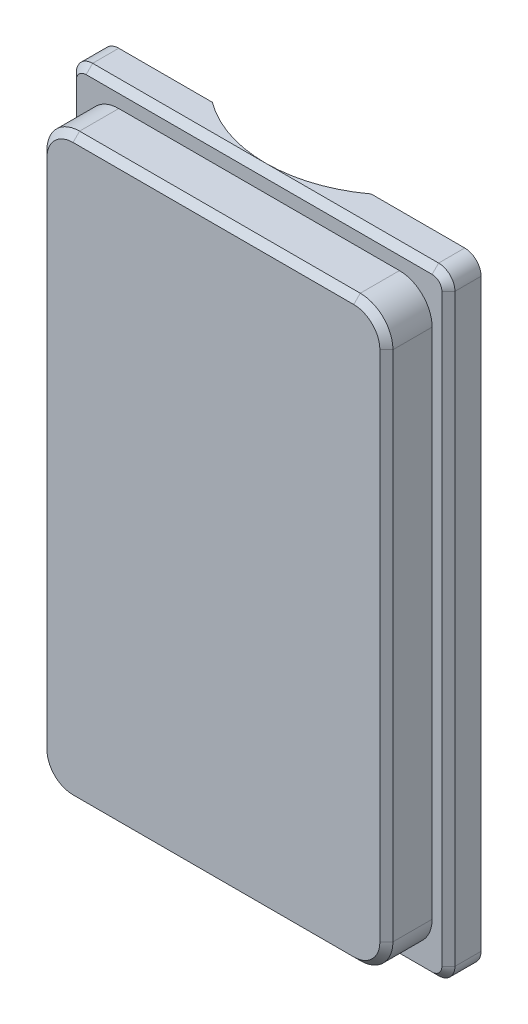
from build123d import *

# Parameters (mm, degrees)
EXTRUDE_1_DEPTH     = 1
SKETCH_3_W          = 5.3
SKETCH_3_H          = 17.71
EXTRUDE_2_DEPTH     = 1.4
FILLET_1_R          = 1
CHAMFER_1_SIZE      = 0.2
CUT_EXTRUDE_1_DEPTH = 0.5
SKETCH_5_R          = 4.1
CUT_EXTRUDE_2_DEPTH = 20.924560345


with BuildPart() as part:
    # 草图1 → 凸台-拉伸1 (new body)
    with BuildSketch(Plane(origin=(0, 0, 0), x_dir=(-1, 0, 0), z_dir=(0, 0, 1))):
        with BuildLine():
            Line((-5.8, 61.063), (-5.8, 78.973))
            ThreePointArc((-5.8, 78.973), (-5.653553391, 79.32655339), (-5.3, 79.473))
            Line((-5.3, 79.473), (0, 79.473))
            Line((0, 79.473), (0, 60.563))
            Line((0, 60.563), (-5.3, 60.563))
            ThreePointArc((-5.3, 60.563), (-5.653553391, 60.709446609), (-5.8, 61.063))
        make_face()
    extrude(amount=EXTRUDE_1_DEPTH)

    # 草图3 → 凸台-拉伸2 (add)
    with BuildSketch(Plane.XY.offset(1)):
        with Locations((2.65, -70.018)):
            Rectangle(SKETCH_3_W, SKETCH_3_H)
    extrude(amount=EXTRUDE_2_DEPTH)

    # 圆角1
    fillet_1_edges = [part.edges().sort_by_distance(p)[0] for p in [
        (5.3, -61.163, 1.7),
        (5.3, -78.873, 1.7),
    ]]
    fillet(fillet_1_edges, radius=FILLET_1_R)

    # 镜向1: part across plane


with BuildPart() as part_1:
    add(part.part)
    add(part.part.mirror(Plane(origin=(0, -79.473, 1), x_dir=(0, 0, 1), z_dir=(1, 0, 0))))

    # 倒角1
    chamfer_1_edges = [part_1.edges().sort_by_distance(p)[0] for p in [
        (5.653553391, -60.709446609, 1),
        (0, -60.563, 1),
        (0, -79.473, 1),
        (0, -78.873, 2.4),
        (0, -61.163, 2.4),
        (5.3, -70.018, 2.4),
        (5.007106781, -78.580106781, 2.4),
        (5.007106781, -61.455893219, 2.4),
        (5.653553391, -79.32655339, 1),
        (-5.653553391, -79.32655339, 1),
        (-5.8, -70.018, 1),
        (-5.653553391, -60.709446609, 1),
        (-5.3, -70.018, 2.4),
        (-5.007106781, -61.455893219, 2.4),
        (-5.007106781, -78.580106781, 2.4),
        (5.8, -70.018, 1),
    ]]
    chamfer(chamfer_1_edges, length=CHAMFER_1_SIZE)

    # 草图4 → 切除-拉伸1 (cut)
    # profile 1 of 9: a face of its own
    with BuildSketch(Plane(origin=(-6.3, -79.273, 0), x_dir=(1, 0, 0), z_dir=(0, 0, 1))):
        with BuildLine():
            add(Edge.make_bspline(
                [(6.774685953, 2.619341222), (6.800289884, 2.617747441), (6.850993025, 2.614591298), (6.925350933, 2.600827188), (6.996555647, 2.579095321), (7.064787892, 2.55036601), (7.129545424, 2.513432463), (7.190880782, 2.468744026), (7.248477435, 2.416001945), (7.302842533, 2.356884778), (7.35236013, 2.291759099), (7.396108136, 2.221845326), (7.432464761, 2.147203781), (7.463443618, 2.069005381), (7.487749635, 1.986705734), (7.505943631, 1.900454217), (7.517046754, 1.809855564), (7.519723963, 1.747989925), (7.521090297, 1.716416298)],
                knots=[0, 0, 0, 0, 0.94827468, 1.87785632, 2.789222779, 3.697428247, 4.610539481, 5.540471281, 6.498511082, 7.494592211, 8.507455324, 9.520496994, 10.539928136, 11.574155348, 12.628388138, 13.710074165, 14.831317928, 16, 16, 16, 16], degree=3))
            add(Edge.make_bspline(
                [(7.521090297, 1.716416298), (7.519727673, 1.684841903), (7.517057736, 1.622974757), (7.505882914, 1.532228766), (7.487825449, 1.44578553), (7.463435671, 1.363341058), (7.432466847, 1.285140562), (7.396107558, 1.210499646), (7.352360383, 1.140585414), (7.302842101, 1.075460941), (7.248478866, 1.016339529), (7.190875764, 0.963612474), (7.129563419, 0.918870324), (7.064666385, 0.8821006), (6.996680813, 0.852631121), (6.925333473, 0.831071458), (6.85085853, 0.817225267), (6.800008805, 0.81409757), (6.774261029, 0.812513859)],
                knots=[0, 0, 0, 0, 1.167698527, 2.287998669, 3.374655933, 4.428001497, 5.461358319, 6.479931524, 7.492120634, 8.504131337, 9.49937418, 10.456607709, 11.385756894, 12.298099667, 13.207905618, 14.118505085, 15.047304403, 16, 16, 16, 16], degree=3))
            Line((6.774261029, 0.812513859), (5.874364878, 0.812513383))
            add(Edge.make_bspline(
                [(5.874364878, 0.812513383), (5.848582314, 0.814095492), (5.797697494, 0.817217963), (5.723188613, 0.831071719), (5.651841188, 0.852631022), (5.583855875, 0.882100737), (5.51895788, 0.918869872), (5.457649221, 0.963614201), (5.400031715, 1.016332762), (5.345724961, 1.075487473), (5.296042879, 1.140416594), (5.253101436, 1.210789424), (5.215889174, 1.284977516), (5.185189379, 1.363376877), (5.16048408, 1.445707285), (5.143464797, 1.53234091), (5.131246322, 1.622922352), (5.128720439, 1.684831116), (5.127431761, 1.716416298)],
                knots=[0, 0, 0, 0, 0.95395145, 1.882731614, 2.793312302, 3.703099491, 4.61542345, 5.544553474, 6.501767263, 7.496989581, 8.508979415, 9.51798526, 10.539210713, 11.572546226, 12.625870068, 13.71129126, 14.832325553, 16, 16, 16, 16], degree=3))
            add(Edge.make_bspline(
                [(5.127431761, 1.716416298), (5.128724004, 1.748000757), (5.131256875, 1.809908103), (5.143403843, 1.900341656), (5.160559346, 1.98678445), (5.185181741, 2.068969445), (5.215891185, 2.147366857), (5.25310088, 2.22155554), (5.296043126, 2.291927922), (5.34572453, 2.356858246), (5.400033145, 2.416008713), (5.457644204, 2.468742294), (5.518975873, 2.513432931), (5.583734371, 2.550365816), (5.651966341, 2.579095634), (5.723171201, 2.600826114), (5.797668042, 2.614621182), (5.84851477, 2.617755875), (5.874261029, 2.619343127)],
                knots=[0, 0, 0, 0, 1.168370235, 2.290072524, 3.370248926, 4.424200417, 5.458151668, 6.479985644, 7.489592731, 8.502185584, 9.49800093, 10.455785099, 11.385468768, 12.298336358, 13.206299492, 14.117422773, 15.046756374, 16, 16, 16, 16], degree=3))
            Line((5.874261029, 2.619343127), (6.774685953, 2.619341222))
        make_face()
        with BuildLine():
            add(Edge.make_bspline(
                [(5.874364878, 2.18617049), (5.86113587, 2.185267658), (5.835045805, 2.183487104), (5.79678859, 2.176788791), (5.760246428, 2.165443937), (5.725755638, 2.149641161), (5.69249254, 2.130544277), (5.661323751, 2.106825267), (5.631484581, 2.079504237), (5.603694252, 2.048280435), (5.578897378, 2.013833692), (5.555843962, 1.97776793), (5.537622496, 1.938845079), (5.521924163, 1.898272763), (5.509143347, 1.855747659), (5.499912343, 1.81103202), (5.493993624, 1.764373863), (5.492875607, 1.732531075), (5.492309809, 1.716416298)],
                knots=[0, 0, 0, 0, 0.94951791, 1.872625918, 2.77529632, 3.682465107, 4.58551123, 5.517397007, 6.48198038, 7.480297679, 8.505438217, 9.520402585, 10.541564555, 11.577763819, 12.635477268, 13.718356008, 14.845321508, 16, 16, 16, 16], degree=3))
            add(Edge.make_bspline(
                [(5.492309809, 1.716416298), (5.492857379, 1.700136765), (5.493928619, 1.668288231), (5.500023035, 1.621494625), (5.509062818, 1.576743135), (5.521933098, 1.534073731), (5.537620202, 1.493499339), (5.55584442, 1.454576696), (5.578897807, 1.418512125), (5.603692071, 1.384060416), (5.631492514, 1.352854654), (5.661295601, 1.325469556), (5.692658583, 1.301928208), (5.725481785, 1.282014249), (5.76038668, 1.267018076), (5.796824481, 1.255662821), (5.834957769, 1.248228341), (5.861058575, 1.246539068), (5.874261029, 1.245684591)],
                knots=[0, 0, 0, 0, 1.165413886, 2.279962417, 3.373403418, 4.430302031, 5.465703032, 6.486078323, 7.500260788, 8.524611583, 9.522159802, 10.486000083, 11.417167958, 12.325429624, 13.227179297, 14.129154303, 15.053678456, 16, 16, 16, 16], degree=3))
            Line((5.874261029, 1.245684591), (6.774685953, 1.245684114))
            add(Edge.make_bspline(
                [(6.774685953, 1.245684114), (6.787745984, 1.246546478), (6.813702874, 1.248260432), (6.85169766, 1.255661522), (6.888135352, 1.267018422), (6.923040295, 1.28201415), (6.955863413, 1.301928256), (6.987226694, 1.325469461), (7.017028613, 1.352855001), (7.044833635, 1.384059065), (7.069610307, 1.418517288), (7.092729184, 1.454557611), (7.110731768, 1.493625448), (7.127361515, 1.533865439), (7.139254764, 1.576854956), (7.148558015, 1.62147613), (7.15457778, 1.66829314), (7.155659382, 1.700138425), (7.156212248, 1.716416298)],
                knots=[0, 0, 0, 0, 0.936755952, 1.861807968, 2.764297963, 3.666562496, 4.57534274, 5.507042272, 6.471432864, 7.469550641, 8.494486296, 9.509247815, 10.530205697, 11.570444156, 12.624670514, 13.718735822, 14.833920713, 16, 16, 16, 16], degree=3))
            add(Edge.make_bspline(
                [(7.156212248, 1.716416298), (7.155641228, 1.732529437), (7.154512891, 1.76436899), (7.148669168, 1.811050658), (7.139176923, 1.855636664), (7.127370725, 1.898481139), (7.110729405, 1.938718949), (7.09272966, 1.977787021), (7.069610731, 2.013828528), (7.044831455, 2.048281786), (7.017036546, 2.079503891), (6.987198544, 2.106825357), (6.956029457, 2.130544245), (6.922766438, 2.149641201), (6.888275615, 2.165443807), (6.851733507, 2.176789272), (6.813510111, 2.183479294), (6.787455247, 2.185267066), (6.774261029, 2.186172396)],
                knots=[0, 0, 0, 0, 1.154786464, 2.281857345, 3.364837343, 4.419373038, 5.45991673, 6.481174187, 7.496233464, 8.521469861, 9.519880511, 10.48455408, 11.416526997, 12.319657563, 13.226911178, 14.129665987, 15.052860313, 16, 16, 16, 16], degree=3))
            Line((6.774261029, 2.186172396), (5.874364878, 2.18617049))
        make_face(mode=Mode.SUBTRACT)
    # profile 2 of 9: a face of its own
    with BuildSketch(Plane(origin=(-6.3, -79.273, 0), x_dir=(1, 0, 0), z_dir=(0, 0, 1))):
        with BuildLine():
            add(Edge.make_bspline(
                [(5.122553712, 3.453167823), (5.12340021, 3.467672021), (5.125038308, 3.495739767), (5.134857134, 3.535708094), (5.15084215, 3.571615935), (5.171977078, 3.603340165), (5.198395949, 3.629166179), (5.22817408, 3.64895025), (5.261862274, 3.661055693), (5.285548184, 3.663213773), (5.297675663, 3.664318737)],
                knots=[0, 0, 0, 0, 1.145665256, 2.217029971, 3.22878967, 4.236712138, 5.208316078, 6.12723863, 7.041122994, 8, 8, 8, 8], degree=3))
            add(Edge.make_bspline(
                [(5.297675663, 3.664318737), (5.310122186, 3.663206732), (5.33443065, 3.66103495), (5.368987459, 3.649086498), (5.399379978, 3.629184196), (5.426253229, 3.60336187), (5.447983758, 3.571761313), (5.463881871, 3.535690792), (5.473698895, 3.495880496), (5.475358587, 3.467952021), (5.476212248, 3.45358703)],
                knots=[0, 0, 0, 0, 0.976287191, 1.906720606, 2.828835859, 3.801627679, 4.808505341, 5.811994192, 6.874600806, 8, 8, 8, 8], degree=3))
            add(Edge.make_bspline(
                [(5.476212248, 3.45358703), (5.480216962, 3.447859363), (5.487865871, 3.436919654), (5.502441531, 3.424264246), (5.517821852, 3.414109466), (5.52941433, 3.411163965), (5.535236639, 3.409684591)],
                knots=[0, 0, 0, 0, 1.106007569, 2.112448186, 3.051979138, 4, 4, 4, 4], degree=3))
            Line((5.535236639, 3.409684591), (7.351157942, 3.409428779))
            add(Edge.make_bspline(
                [(7.351157942, 3.409428779), (7.363032707, 3.408634539), (7.386353933, 3.407074704), (7.419452124, 3.394599253), (7.449164286, 3.375211888), (7.474895075, 3.349048859), (7.49636043, 3.317915263), (7.51212455, 3.282375719), (7.521458304, 3.2428273), (7.523140678, 3.215263653), (7.524017127, 3.200904103)],
                knots=[0, 0, 0, 0, 0.946687369, 1.85922917, 2.78909143, 3.763031202, 4.772218789, 5.796023415, 6.851816938, 8, 8, 8, 8], degree=3))
            add(Edge.make_bspline(
                [(7.524017127, 3.200904103), (7.523123946, 3.186548133), (7.521399624, 3.158833342), (7.512216042, 3.11908638), (7.496359803, 3.083397058), (7.474872087, 3.052306475), (7.449313234, 3.026047522), (7.419299783, 3.007245461), (7.38622211, 2.99484166), (7.362825457, 2.992721388), (7.350846395, 2.99163581)],
                knots=[0, 0, 0, 0, 1.145841184, 2.212093514, 3.233809949, 4.240939159, 5.212892446, 6.133855195, 7.044535741, 8, 8, 8, 8], degree=3))
            Line((7.350846395, 2.99163581), (5.535616307, 2.991635334))
            add(Edge.make_bspline(
                [(5.535616307, 2.991635334), (5.52147394, 2.992480055), (5.49363036, 2.994143146), (5.452972897, 3.001658491), (5.413960119, 3.012817345), (5.376895286, 3.028564797), (5.341534007, 3.048135935), (5.308200847, 3.071907721), (5.276203383, 3.099205853), (5.2469093, 3.130975337), (5.219565994, 3.165116772), (5.196258227, 3.202191078), (5.17545916, 3.240584189), (5.158893435, 3.281543237), (5.145670067, 3.32463437), (5.136114026, 3.369868117), (5.129530146, 3.417147533), (5.128141278, 3.44933755), (5.127431761, 3.465782152)],
                knots=[0, 0, 0, 0, 0.980581761, 1.930575478, 2.857315967, 3.786107525, 4.713805743, 5.651298114, 6.617643132, 7.621653236, 8.640152693, 9.643088211, 10.650818869, 11.661064142, 12.697834104, 13.769264831, 14.860405998, 16, 16, 16, 16], degree=3))
            Line((5.127431761, 3.465782152), (5.122553712, 3.453167823))
        make_face()
    # profile 3 of 9: a face of its own
    with BuildSketch(Plane(origin=(-6.3, -79.273, 0), x_dir=(1, 0, 0), z_dir=(0, 0, 1))):
        with BuildLine():
            add(Edge.make_bspline(
                [(5.64191061, 4.015635334), (5.62418692, 4.016672194), (5.589410752, 4.018706648), (5.538711188, 4.029035747), (5.489880743, 4.043323024), (5.443556301, 4.064333492), (5.398638366, 4.089469286), (5.356819988, 4.121296249), (5.31645088, 4.157335619), (5.279374608, 4.198926822), (5.244666177, 4.243708141), (5.214964972, 4.292546569), (5.189080472, 4.343711052), (5.167290141, 4.397624369), (5.151133226, 4.454484915), (5.138049576, 4.513703407), (5.130484169, 4.575946091), (5.128462736, 4.618382529), (5.127431761, 4.640026054)],
                knots=[0, 0, 0, 0, 0.951543996, 1.867052271, 2.76966306, 3.675977574, 4.590487385, 5.525863222, 6.489621794, 7.490352572, 8.511268695, 9.525901277, 10.552172671, 11.585909569, 12.640644114, 13.72052336, 14.837416339, 16, 16, 16, 16], degree=3))
            Line((5.127431761, 4.640026054), (5.127431761, 5.322837125))
            add(Edge.make_bspline(
                [(5.127431761, 5.322837125), (5.128250913, 5.337736061), (5.129824967, 5.366365347), (5.139987455, 5.407436865), (5.155825325, 5.444890846), (5.178604209, 5.47731656), (5.204929139, 5.505304452), (5.236568776, 5.524782379), (5.270919484, 5.538525945), (5.295427639, 5.540488927), (5.307919566, 5.541489469)],
                knots=[0, 0, 0, 0, 1.138391563, 2.187494374, 3.217350047, 4.227515487, 5.203137744, 6.130703494, 7.047210442, 8, 8, 8, 8], degree=3))
            Line((5.307919566, 5.541489469), (7.350097538, 5.54148804))
            add(Edge.make_bspline(
                [(7.350097538, 5.54148804), (7.362019452, 5.540454253), (7.385642998, 5.538405781), (7.418758057, 5.524904351), (7.449029163, 5.505054328), (7.474420765, 5.477310228), (7.495936614, 5.444581323), (7.51215364, 5.407546654), (7.521430449, 5.366314652), (7.523131708, 5.337795596), (7.524017127, 5.322952884)],
                knots=[0, 0, 0, 0, 0.925618035, 1.834133467, 2.745721925, 3.720426658, 4.733716554, 5.781128243, 6.845190584, 8, 8, 8, 8], degree=3))
            add(Edge.make_bspline(
                [(7.524017127, 5.322952884), (7.523107834, 5.308280032), (7.521351466, 5.2799383), (7.512362947, 5.239073206), (7.495747355, 5.202712365), (7.474620937, 5.170462674), (7.448653567, 5.143878083), (7.419009351, 5.123639979), (7.385339341, 5.11166282), (7.36182959, 5.109446249), (7.349870785, 5.108318737)],
                knots=[0, 0, 0, 0, 1.151935465, 2.225051238, 3.25803624, 4.269315285, 5.233953352, 6.153297938, 7.060630248, 8, 8, 8, 8], degree=3))
            Line((7.349870785, 5.108318737), (6.803528845, 5.108317308))
            Line((6.803528845, 5.108317308), (6.803528845, 4.639603512))
            add(Edge.make_bspline(
                [(6.803528845, 4.639603512), (6.802290695, 4.618102812), (6.799855864, 4.575821562), (6.792411473, 4.513714228), (6.77948342, 4.454393814), (6.762573248, 4.39770287), (6.740876127, 4.34374342), (6.715193156, 4.29222938), (6.684163021, 4.244033886), (6.64973905, 4.198701185), (6.612022193, 4.157530973), (6.571695976, 4.121099589), (6.529439484, 4.089624077), (6.484493641, 4.06431863), (6.438017684, 4.043229486), (6.38882481, 4.029046753), (6.337912754, 4.018765438), (6.303091671, 4.016687002), (6.285480541, 4.01563581)],
                knots=[0, 0, 0, 0, 1.15353325, 2.268429813, 3.346378802, 4.401710962, 5.433600081, 6.458037042, 7.480101589, 8.49919285, 9.504003122, 10.466039, 11.406744591, 12.319619739, 13.224314239, 14.133650694, 15.056074184, 16, 16, 16, 16], degree=3))
            Line((6.285480541, 4.01563581), (5.64191061, 4.015635334))
        make_face()
        with BuildLine():
            Line((6.438650796, 5.108317308), (5.492309809, 5.108317308))
            Line((5.492309809, 5.108317308), (5.492309809, 4.639603512))
            add(Edge.make_bspline(
                [(5.492309809, 4.639603512), (5.493077384, 4.626854886), (5.494568825, 4.602083581), (5.502934273, 4.566392938), (5.516722182, 4.533964421), (5.535081683, 4.504972131), (5.557862762, 4.481392794), (5.583154974, 4.46288615), (5.611654141, 4.451854311), (5.631573047, 4.449825561), (5.641578102, 4.448806542)],
                knots=[0, 0, 0, 0, 1.146504479, 2.227723435, 3.275533308, 4.301194785, 5.293513974, 6.205873749, 7.098829466, 8, 8, 8, 8], degree=3))
            Line((5.641578102, 4.448806542), (6.285844489, 4.448806066))
            add(Edge.make_bspline(
                [(6.285844489, 4.448806066), (6.296212211, 4.44982502), (6.3167979, 4.451848211), (6.346183743, 4.462760386), (6.372108628, 4.481218509), (6.394827087, 4.505134863), (6.413844194, 4.533796497), (6.427502788, 4.566416747), (6.435949568, 4.602214344), (6.437408591, 4.627133344), (6.438163468, 4.640026054)],
                knots=[0, 0, 0, 0, 0.923098965, 1.832864354, 2.746636279, 3.727612043, 4.749444418, 5.785276539, 6.854135836, 8, 8, 8, 8], degree=3))
            Line((6.438163468, 4.640026054), (6.438650796, 5.108317308))
        make_face(mode=Mode.SUBTRACT)
    # profile 4 of 9: a face of its own
    with BuildSketch(Plane(origin=(-6.3, -79.273, 0), x_dir=(1, 0, 0), z_dir=(0, 0, 1))):
        with BuildLine():
            add(Edge.make_bspline(
                [(5.483332104, 6.683303874), (5.485448601, 6.660339253), (5.489567034, 6.615653039), (5.507466294, 6.55214269), (5.533965242, 6.494781844), (5.568481512, 6.444664895), (5.609160677, 6.402696154), (5.655680896, 6.371794268), (5.707143141, 6.352224953), (5.743200913, 6.348732729), (5.761578102, 6.346952884)],
                knots=[0, 0, 0, 0, 1.152723077, 2.243051527, 3.284729085, 4.303178847, 5.27606439, 6.192795705, 7.078941055, 8, 8, 8, 8], degree=3))
            Line((5.761578102, 6.346952884), (6.884809809, 6.346952407))
            add(Edge.make_bspline(
                [(6.884809809, 6.346952407), (6.90322765, 6.348779539), (6.939611667, 6.352388996), (6.991579538, 6.3713876), (7.037901787, 6.402927247), (7.07858593, 6.444396049), (7.112275291, 6.494672608), (7.136494832, 6.552187645), (7.152833107, 6.615506922), (7.15505989, 6.660016677), (7.156212248, 6.683050444)],
                knots=[0, 0, 0, 0, 0.927308887, 1.831877266, 2.745000803, 3.72128324, 4.73410518, 5.766054053, 6.84393453, 8, 8, 8, 8], degree=3))
            Line((7.156212248, 6.683050444), (7.156699101, 7.506842842))
            add(Edge.make_bspline(
                [(7.156699101, 7.506842842), (7.157267736, 7.521752002), (7.15836245, 7.550454493), (7.169211989, 7.591130776), (7.185160446, 7.627799989), (7.207367072, 7.659552325), (7.233782279, 7.686466311), (7.265518526, 7.704833698), (7.299900939, 7.718223453), (7.324533916, 7.719801023), (7.337187858, 7.72061142)],
                knots=[0, 0, 0, 0, 1.147643246, 2.209394622, 3.225718433, 4.217360048, 5.184177568, 6.107033161, 7.027584279, 8, 8, 8, 8], degree=3))
            add(Edge.make_bspline(
                [(7.337187858, 7.72061142), (7.349837634, 7.719784268), (7.374616041, 7.718164041), (7.4093191, 7.704836061), (7.441571992, 7.686514837), (7.468412835, 7.659431917), (7.491674799, 7.627996843), (7.508194071, 7.591225706), (7.518788774, 7.550459721), (7.520303883, 7.521818855), (7.521090297, 7.506952884)],
                knots=[0, 0, 0, 0, 0.966444608, 1.893073575, 2.820959557, 3.790775214, 4.790729761, 5.805954028, 6.861185726, 8, 8, 8, 8], degree=3))
            Line((7.521090297, 7.506952884), (7.521577626, 6.682651721))
            add(Edge.make_bspline(
                [(7.521577626, 6.682651721), (7.520290355, 6.655932055), (7.517756712, 6.60334165), (7.508204044, 6.526077658), (7.492279587, 6.452329157), (7.47221742, 6.381756472), (7.445639818, 6.315223406), (7.413721687, 6.252150323), (7.37613937, 6.192833938), (7.333823803, 6.137230744), (7.287493055, 6.08684508), (7.237749143, 6.042714299), (7.186060307, 6.004171902), (7.131049985, 5.972662737), (7.073031373, 5.94846772), (7.012730968, 5.929523167), (6.949483678, 5.917764278), (6.906339752, 5.915120266), (6.884504931, 5.913782152)],
                knots=[0, 0, 0, 0, 1.161612702, 2.286319017, 3.376369762, 4.435675978, 5.469053187, 6.482868206, 7.501688539, 8.514420738, 9.513942875, 10.469304235, 11.398707525, 12.309683497, 13.214727573, 14.123867699, 15.050503342, 16, 16, 16, 16], degree=3))
            Line((6.884504931, 5.913782152), (5.761762934, 5.913781675))
            add(Edge.make_bspline(
                [(5.761762934, 5.913781675), (5.739864807, 5.91510768), (5.696815317, 5.91771447), (5.633835378, 5.929530089), (5.574009923, 5.948452425), (5.516389878, 5.972788267), (5.461473219, 6.004152159), (5.409825676, 6.042741852), (5.360030826, 6.086677909), (5.314278447, 6.13743025), (5.271776508, 6.192654242), (5.234949454, 6.25233275), (5.202664334, 6.315071906), (5.177142736, 6.381982932), (5.155828859, 6.452142625), (5.141232226, 6.526210521), (5.130389713, 6.603399023), (5.128429531, 6.656182598), (5.127431761, 6.683050444)],
                knots=[0, 0, 0, 0, 0.953463774, 1.874412746, 2.778039622, 3.677811996, 4.590031397, 5.520703266, 6.477368638, 7.473472036, 8.487586555, 9.504040725, 10.519239542, 11.551438491, 12.614192351, 13.704286828, 14.831438197, 16, 16, 16, 16], degree=3))
            Line((5.127431761, 6.683050444), (5.127431761, 7.506842842))
            add(Edge.make_bspline(
                [(5.127431761, 7.506842842), (5.128215456, 7.521745818), (5.129723547, 7.55042409), (5.140328109, 7.591225717), (5.156847228, 7.62799684), (5.180109231, 7.659431918), (5.206950064, 7.686514837), (5.239202958, 7.704836061), (5.273906017, 7.718164041), (5.298684423, 7.719784268), (5.3113342, 7.72061142)],
                knots=[0, 0, 0, 0, 1.141216098, 2.196078402, 3.21094728, 4.210551784, 5.180027947, 6.107589113, 7.033893705, 8, 8, 8, 8], degree=3))
            Line((5.3113342, 7.72061142), (6.432056856, 7.720609515))
            add(Edge.make_bspline(
                [(6.432056856, 7.720609515), (6.444626919, 7.719775004), (6.469324055, 7.718135394), (6.503953123, 7.704836181), (6.536206173, 7.686514803), (6.563046972, 7.659431927), (6.586308948, 7.62799684), (6.602828216, 7.591225706), (6.61342292, 7.55045972), (6.61493803, 7.521818855), (6.615724444, 7.506952884)],
                knots=[0, 0, 0, 0, 0.961194782, 1.888515383, 2.817093936, 3.78763346, 4.788334371, 5.804316398, 6.860335719, 8, 8, 8, 8], degree=3))
            Line((6.615724444, 7.506952884), (6.616211772, 7.099417156))
            add(Edge.make_bspline(
                [(6.616211772, 7.099417156), (6.615174296, 7.0846407), (6.613149653, 7.055804318), (6.603101094, 7.01462041), (6.585997525, 6.977513664), (6.563302412, 6.945172497), (6.535900348, 6.917885648), (6.504415004, 6.897557286), (6.469159674, 6.884730978), (6.444447642, 6.882650148), (6.431822005, 6.88158703)],
                knots=[0, 0, 0, 0, 1.124580428, 2.194628496, 3.201054364, 4.212475683, 5.182505617, 6.121819445, 7.040417821, 8, 8, 8, 8], degree=3))
            add(Edge.make_bspline(
                [(6.431822005, 6.88158703), (6.419192642, 6.882633793), (6.394626369, 6.884669928), (6.359687788, 6.897566799), (6.328725094, 6.917929803), (6.301744847, 6.945059546), (6.280103088, 6.977699919), (6.263576791, 7.01471797), (6.253257069, 7.055840858), (6.251664174, 7.084779137), (6.250846395, 7.09963581)],
                knots=[0, 0, 0, 0, 0.965072278, 1.877230911, 2.811477289, 3.778228858, 4.781367767, 5.788425953, 6.864596133, 8, 8, 8, 8], degree=3))
            Line((6.250846395, 7.09963581), (6.251333723, 7.289011287))
            Line((6.251333723, 7.289011287), (5.492309809, 7.289011287))
            Line((5.492309809, 7.289011287), (5.483332104, 6.683303874))
        make_face()
    # profile 5 of 9: a face of its own
    with BuildSketch(Plane(origin=(-6.3, -79.273, 0), x_dir=(1, 0, 0), z_dir=(0, 0, 1))):
        with BuildLine():
            Line((5.78304104, 9.618756332), (6.188556951, 9.618756332))
            add(Edge.make_bspline(
                [(6.188556951, 9.618756332), (6.20921028, 9.617424091), (6.25021646, 9.614778991), (6.310224261, 9.602836565), (6.368059337, 9.584715601), (6.423300601, 9.559623746), (6.476255126, 9.528172504), (6.526887665, 9.490349774), (6.574647905, 9.445597887), (6.619738365, 9.395175205), (6.660880208, 9.33974351), (6.697817212, 9.280782527), (6.72840163, 9.217780899), (6.754455756, 9.151812631), (6.77499374, 9.082103096), (6.789882057, 9.008982988), (6.799912806, 8.932513711), (6.80198574, 8.880414585), (6.803041517, 8.853879713)],
                knots=[0, 0, 0, 0, 0.916292159, 1.819253497, 2.703419541, 3.59669853, 4.501239603, 5.427838288, 6.391433554, 7.39669121, 8.421284483, 9.447017191, 10.474949228, 11.519936788, 12.586900617, 13.690530484, 14.823752287, 16, 16, 16, 16], degree=3))
            add(Edge.make_bspline(
                [(6.803041517, 8.853879713), (6.801991066, 8.827506958), (6.799935202, 8.775892193), (6.789895271, 8.700229631), (6.774917369, 8.627945936), (6.754483642, 8.558853928), (6.728264486, 8.49329012), (6.697972855, 8.430460484), (6.660724446, 8.371848968), (6.61973283, 8.316502426), (6.574812011, 8.266046617), (6.526718885, 8.221818831), (6.476272071, 8.183966763), (6.423309506, 8.152487097), (6.367962696, 8.127576356), (6.310324824, 8.108673205), (6.250154318, 8.096913528), (6.209106375, 8.094248155), (6.18840737, 8.092904103)],
                knots=[0, 0, 0, 0, 1.173145474, 2.295991786, 3.389326865, 4.45309377, 5.495012025, 6.526542102, 7.549726577, 8.577906204, 9.586682534, 10.54874524, 11.478587271, 12.386294483, 13.282700191, 14.172167919, 15.078289867, 16, 16, 16, 16], degree=3))
            Line((6.18840737, 8.092904103), (5.636103636, 8.092903627))
            add(Edge.make_bspline(
                [(5.636103636, 8.092903627), (5.618687056, 8.093934407), (5.584535712, 8.095955615), (5.534660082, 8.106389949), (5.486577854, 8.120495843), (5.441086989, 8.14160516), (5.397093531, 8.16689898), (5.355797397, 8.198536118), (5.315992164, 8.234797685), (5.278775096, 8.275988312), (5.244848096, 8.321319122), (5.214251408, 8.369500662), (5.189238795, 8.421146272), (5.167239086, 8.474865326), (5.151147367, 8.531760779), (5.138045627, 8.590969586), (5.130485218, 8.653214945), (5.12846309, 8.695651011), (5.127431761, 8.717294347)],
                knots=[0, 0, 0, 0, 0.940339096, 1.843866273, 2.743250278, 3.638729962, 4.543279326, 5.476985431, 6.43976515, 7.446225619, 8.46768576, 9.492758237, 10.520981099, 11.560636664, 12.621410099, 13.7074722, 14.830759959, 16, 16, 16, 16], degree=3))
            Line((5.127431761, 8.717294347), (5.127431761, 9.400105418))
            add(Edge.make_bspline(
                [(5.127431761, 9.400105418), (5.128250913, 9.415004353), (5.129824967, 9.44363364), (5.139987455, 9.484705158), (5.155825325, 9.522159138), (5.178604209, 9.554584853), (5.204929139, 9.582572745), (5.236568776, 9.602050672), (5.270919484, 9.615794238), (5.295427639, 9.61775722), (5.307919566, 9.618757762)],
                knots=[0, 0, 0, 0, 1.138391563, 2.187494374, 3.217350047, 4.227515487, 5.203137744, 6.130703494, 7.047210442, 8, 8, 8, 8], degree=3))
            add(Edge.make_bspline(
                [(5.307919566, 9.618757762), (5.32072935, 9.617750831), (5.345855745, 9.615775737), (5.381095419, 9.602192177), (5.413291131, 9.58256816), (5.440201847, 9.554767849), (5.462849585, 9.522028989), (5.479258076, 9.484763258), (5.490030442, 9.443733292), (5.491530966, 9.415088952), (5.492309809, 9.400221176)],
                knots=[0, 0, 0, 0, 0.968685772, 1.900077285, 2.829756606, 3.805310362, 4.806426797, 5.832025487, 6.874718055, 8, 8, 8, 8], degree=3))
            Line((5.492309809, 9.400221176), (5.492309809, 8.716871805))
            add(Edge.make_bspline(
                [(5.492309809, 8.716871805), (5.493121393, 8.704130558), (5.494696036, 8.67940987), (5.502425299, 8.643713627), (5.515686632, 8.611215702), (5.533679104, 8.58264992), (5.554904773, 8.558360054), (5.579553615, 8.54049395), (5.606848713, 8.529011256), (5.626024821, 8.527061206), (5.635724444, 8.526074835)],
                knots=[0, 0, 0, 0, 1.165164728, 2.260663639, 3.319814879, 4.354202631, 5.332356577, 6.247471425, 7.113539359, 8, 8, 8, 8], degree=3))
            Line((5.635724444, 8.526074835), (5.78304104, 8.526074358))
            Line((5.78304104, 8.526074358), (5.78304104, 9.618756332))
        make_face()
        with BuildLine():
            add(Edge.make_bspline(
                [(6.438650796, 8.853748234), (6.437369986, 8.876315935), (6.43489599, 8.919907417), (6.420310671, 8.98225033), (6.398165916, 9.039098475), (6.366950975, 9.088679973), (6.32961579, 9.129955935), (6.287092094, 9.161238575), (6.239214168, 9.180828947), (6.205492452, 9.183987003), (6.18840737, 9.18558703)],
                knots=[0, 0, 0, 0, 1.181532699, 2.282233465, 3.336661472, 4.361780037, 5.331867908, 6.234422029, 7.105471251, 8, 8, 8, 8], degree=3))
            Line((6.18840737, 9.18558703), (6.147919566, 9.185585601))
            Line((6.147919566, 9.185585601), (6.147919566, 8.526074358))
            Line((6.147919566, 8.526074358), (6.188556951, 8.526074358))
            add(Edge.make_bspline(
                [(6.188556951, 8.526074358), (6.205577159, 8.527720052), (6.239159171, 8.530967116), (6.287056432, 8.549864065), (6.329590258, 8.580707723), (6.366968243, 8.621478537), (6.397891455, 8.670380899), (6.420584179, 8.726364845), (6.43490877, 8.788136271), (6.437056701, 8.831523519), (6.438650796, 8.853748234)],
                knots=[0, 0, 0, 0, 0.898603461, 1.773004862, 2.677306445, 3.648329679, 4.673844513, 5.712296624, 6.821212649, 8, 8, 8, 8], degree=3))
        make_face(mode=Mode.SUBTRACT)
    # profile 6 of 9: a face of its own
    with BuildSketch(Plane(origin=(-6.3, -79.273, 0), x_dir=(1, 0, 0), z_dir=(0, 0, 1))):
        with BuildLine():
            add(Edge.make_bspline(
                [(5.297885267, 9.994650387), (5.285663922, 9.995617746), (5.261797149, 9.997506878), (5.228302511, 10.010481951), (5.198197768, 10.030038224), (5.172169974, 10.056448047), (5.150548194, 10.088315929), (5.134907212, 10.125089242), (5.125022169, 10.165995965), (5.123394871, 10.1947328), (5.122553712, 10.20958703)],
                knots=[0, 0, 0, 0, 0.952500454, 1.860115524, 2.76835155, 3.737588794, 4.733789719, 5.757030911, 6.840596767, 8, 8, 8, 8], degree=3))
            add(Edge.make_bspline(
                [(5.122553712, 10.20958703), (5.123373835, 10.224121578), (5.124950783, 10.252068898), (5.135064238, 10.291957662), (5.150693454, 10.328006807), (5.171994215, 10.359818426), (5.19839059, 10.385664978), (5.228179351, 10.405405081), (5.261826355, 10.417659853), (5.285542709, 10.419418856), (5.297675663, 10.420318737)],
                knots=[0, 0, 0, 0, 1.147542827, 2.206518294, 3.230096122, 4.238088033, 5.209758914, 6.128744777, 7.042692104, 8, 8, 8, 8], degree=3))
            Line((5.297675663, 10.420318737), (6.457770937, 10.420162487))
            Line((6.457770937, 10.420162487), (6.457770937, 10.797044633))
            Line((6.457770937, 10.797044633), (6.392135934, 10.801102845))
            add(Edge.make_bspline(
                [(6.392135934, 10.801102845), (6.380224509, 10.802284931), (6.35691377, 10.804598281), (6.32369963, 10.816805465), (6.293978949, 10.836266682), (6.268321676, 10.86243765), (6.246508391, 10.893525303), (6.23181882, 10.929808422), (6.221484504, 10.969519034), (6.219941531, 10.997482901), (6.219139078, 11.012026054)],
                knots=[0, 0, 0, 0, 0.948528589, 1.85627681, 2.781254506, 3.750078175, 4.753964502, 5.779095098, 6.844975137, 8, 8, 8, 8], degree=3))
            add(Edge.make_bspline(
                [(6.219139078, 11.012026054), (6.219966992, 11.026885979), (6.221568665, 11.055633832), (6.231617639, 11.096401347), (6.246642894, 11.133515987), (6.268190689, 11.165357413), (6.293666599, 11.192300862), (6.32398333, 11.210875536), (6.35662959, 11.224142444), (6.379983292, 11.225813228), (6.391822005, 11.226660201)],
                knots=[0, 0, 0, 0, 1.167236176, 2.258122618, 3.283272399, 4.296810141, 5.263602734, 6.171074471, 7.0728612, 8, 8, 8, 8], degree=3))
            Line((6.391822005, 11.226660201), (6.621091726, 11.226614945))
            add(Edge.make_bspline(
                [(6.621091726, 11.226614945), (6.633743546, 11.225821478), (6.658374494, 11.224276733), (6.69278238, 11.21090232), (6.724508364, 11.192369115), (6.751584916, 11.165611208), (6.773837438, 11.133428448), (6.790930208, 11.096767389), (6.800497641, 11.05558566), (6.802174658, 11.026869564), (6.803041517, 11.012026054)],
                knots=[0, 0, 0, 0, 0.96755155, 1.883658949, 2.8020597, 3.773156842, 4.777385176, 5.79395093, 6.859680931, 8, 8, 8, 8], degree=3))
            Line((6.803041517, 11.012026054), (6.803528845, 10.209695166))
            add(Edge.make_bspline(
                [(6.803528845, 10.209695166), (6.802441017, 10.19466115), (6.800328033, 10.165459281), (6.791054795, 10.123533799), (6.773830961, 10.086258221), (6.751607805, 10.053575917), (6.724518772, 10.02639998), (6.69292592, 10.007186392), (6.658321308, 9.994075557), (6.633731671, 9.992077588), (6.621090297, 9.991050444)],
                knots=[0, 0, 0, 0, 1.145322919, 2.224659683, 3.242510005, 4.247064397, 5.21726748, 6.133115094, 7.040246537, 8, 8, 8, 8], degree=3))
            Line((6.621090297, 9.991050444), (5.297885267, 9.994650387))
        make_face()
    # profile 7 of 9: a face of its own
    with BuildSketch(Plane(origin=(-6.3, -79.273, 0), x_dir=(1, 0, 0), z_dir=(0, 0, 1))):
        with BuildLine():
            add(Edge.make_bspline(
                [(6.803528845, 11.85808541), (6.802453204, 11.843371231), (6.800364723, 11.81480196), (6.790865012, 11.773599298), (6.773857617, 11.736592102), (6.751492416, 11.703839606), (6.724392035, 11.676400946), (6.69322578, 11.655877381), (6.658249227, 11.643125012), (6.633714234, 11.640692357), (6.621090297, 11.639440688)],
                knots=[0, 0, 0, 0, 1.124238703, 2.182838799, 3.203883666, 4.211590874, 5.193567112, 6.125580558, 7.035559052, 8, 8, 8, 8], degree=3))
            Line((6.621090297, 11.639440688), (5.29706162, 11.639440212))
            add(Edge.make_bspline(
                [(5.29706162, 11.639440212), (5.285128166, 11.640710656), (5.261746617, 11.643199872), (5.228406826, 11.655923182), (5.198668491, 11.676467083), (5.17316631, 11.704085537), (5.151492162, 11.736505927), (5.136589329, 11.773962061), (5.126430825, 11.814852122), (5.124839626, 11.843603389), (5.124017127, 11.858465079)],
                knots=[0, 0, 0, 0, 0.931310382, 1.824742527, 2.744686518, 3.720752625, 4.735457786, 5.762797711, 6.843577658, 8, 8, 8, 8], degree=3))
            add(Edge.make_bspline(
                [(5.124017127, 11.858465079), (5.124839743, 11.873164628), (5.126430795, 11.901595568), (5.13658273, 11.942008048), (5.15152053, 11.978970068), (5.173044499, 12.010860866), (5.198695663, 12.037688536), (5.228702736, 12.056912232), (5.261527232, 12.070063131), (5.284867932, 12.071754177), (5.296700053, 12.07261142)],
                knots=[0, 0, 0, 0, 1.157147383, 2.238081277, 3.265574424, 4.281428989, 5.25043155, 6.166893773, 7.070741875, 8, 8, 8, 8], degree=3))
            Line((5.296700053, 12.07261142), (6.438650796, 12.072610944))
            Line((6.438650796, 12.072610944), (6.438650796, 12.451146576))
            Line((6.438650796, 12.451146576), (5.29706162, 12.451146576))
            add(Edge.make_bspline(
                [(5.29706162, 12.451146576), (5.285110624, 12.452194615), (5.261672435, 12.45425002), (5.228714021, 12.467318468), (5.19853614, 12.486567335), (5.173051318, 12.513926859), (5.151519575, 12.546268931), (5.136410279, 12.583998844), (5.126464506, 12.625606184), (5.124850849, 12.654990497), (5.124017127, 12.670172396)],
                knots=[0, 0, 0, 0, 0.926626821, 1.817292426, 2.720388176, 3.684305139, 4.695868235, 5.720026971, 6.822013624, 8, 8, 8, 8], degree=3))
            add(Edge.make_bspline(
                [(5.124017127, 12.670172396), (5.124839743, 12.684871946), (5.126430795, 12.713302885), (5.13658273, 12.753715365), (5.15152053, 12.790677385), (5.173044499, 12.822568183), (5.198695663, 12.849395853), (5.228702736, 12.868619549), (5.261527232, 12.881770448), (5.284867932, 12.883461494), (5.296700053, 12.884318737)],
                knots=[0, 0, 0, 0, 1.157147383, 2.238081277, 3.265574424, 4.281428989, 5.25043155, 6.166893773, 7.070741875, 8, 8, 8, 8], degree=3))
            Line((5.296700053, 12.884318737), (6.438650796, 12.884317308))
            Line((6.438650796, 12.884317308), (6.438650796, 13.07561304))
            add(Edge.make_bspline(
                [(6.438650796, 13.07561304), (6.437741001, 13.088327191), (6.435979659, 13.112941466), (6.426984943, 13.147982696), (6.413300785, 13.180091393), (6.393798575, 13.208037222), (6.370615912, 13.23147926), (6.34415911, 13.249459477), (6.314140653, 13.259744567), (6.293193558, 13.261807486), (6.282553712, 13.262855323)],
                knots=[0, 0, 0, 0, 1.133331057, 2.194100189, 3.205786612, 4.226143022, 5.209230685, 6.129053034, 7.049673098, 8, 8, 8, 8], degree=3))
            Line((6.282553712, 13.262855323), (5.29706162, 13.262853417))
            add(Edge.make_bspline(
                [(5.29706162, 13.262853417), (5.285110629, 13.263901656), (5.261672472, 13.26595745), (5.228714016, 13.279025753), (5.198536141, 13.298274662), (5.173051318, 13.325634173), (5.151519575, 13.357976248), (5.136410279, 13.395706161), (5.126464506, 13.437313501), (5.124850849, 13.466697814), (5.124017127, 13.481879713)],
                knots=[0, 0, 0, 0, 0.926628306, 1.817293724, 2.720389285, 3.684306045, 4.695868928, 5.720027449, 6.822013871, 8, 8, 8, 8], degree=3))
            add(Edge.make_bspline(
                [(5.124017127, 13.481879713), (5.124839743, 13.496579263), (5.126430795, 13.525010202), (5.13658273, 13.565422682), (5.15152053, 13.602384702), (5.173044499, 13.6342755), (5.198695663, 13.66110317), (5.228702736, 13.680326867), (5.261527232, 13.693477765), (5.284867932, 13.695168811), (5.296700053, 13.696026054)],
                knots=[0, 0, 0, 0, 1.157147383, 2.238081277, 3.265574424, 4.281428989, 5.25043155, 6.166893773, 7.070741875, 8, 8, 8, 8], degree=3))
            Line((5.296700053, 13.696026054), (6.282628502, 13.696024149))
            add(Edge.make_bspline(
                [(6.282628502, 13.696024149), (6.300376324, 13.694971656), (6.33549334, 13.692889123), (6.386872336, 13.682622836), (6.43652779, 13.66840842), (6.483438677, 13.647507882), (6.528388392, 13.621856748), (6.571181094, 13.59109393), (6.612142147, 13.555251346), (6.649717902, 13.513908824), (6.68403072, 13.468682532), (6.715187771, 13.420911691), (6.740994702, 13.369762779), (6.762461108, 13.316036183), (6.779509788, 13.259719807), (6.792375494, 13.200874277), (6.79997878, 13.139296882), (6.802009512, 13.097345493), (6.803041517, 13.076026054)],
                knots=[0, 0, 0, 0, 0.952233279, 1.884151937, 2.802761483, 3.716350927, 4.63014836, 5.573739761, 6.537457744, 7.543283183, 8.563404039, 9.57915637, 10.596852582, 11.629784227, 12.677838629, 13.748354147, 14.855727349, 16, 16, 16, 16], degree=3))
            Line((6.803041517, 13.076026054), (6.803528845, 11.85808541))
        make_face()
    # profile 8 of 9: a face of its own
    with BuildSketch(Plane(origin=(-6.3, -79.273, 0), x_dir=(1, 0, 0), z_dir=(0, 0, 1))):
        with BuildLine():
            add(Edge.make_bspline(
                [(5.127431761, 15.406739564), (5.128250913, 15.4216385), (5.129824967, 15.450267786), (5.139987455, 15.491339304), (5.155825325, 15.528793285), (5.178604209, 15.561218999), (5.204929139, 15.589206891), (5.236568776, 15.608684818), (5.270919484, 15.622428384), (5.295427639, 15.624391366), (5.307919566, 15.625391908)],
                knots=[0, 0, 0, 0, 1.138391563, 2.187494374, 3.217350047, 4.227515487, 5.203137744, 6.130703494, 7.047210442, 8, 8, 8, 8], degree=3))
            Line((5.307919566, 15.625391908), (6.291713392, 15.625390479))
            add(Edge.make_bspline(
                [(6.291713392, 15.625390479), (6.308867609, 15.624316545), (6.342905699, 15.622185603), (6.392850416, 15.612160832), (6.44096297, 15.597017466), (6.487135949, 15.576399814), (6.53106353, 15.550225758), (6.573526799, 15.519553342), (6.612968684, 15.482274024), (6.650727192, 15.440872892), (6.685194179, 15.39516224), (6.715559581, 15.346417948), (6.740937961, 15.294624835), (6.762478088, 15.240525704), (6.779580523, 15.183566014), (6.792313901, 15.124044719), (6.800013093, 15.061673095), (6.802018642, 15.019232616), (6.803041517, 14.99758703)],
                knots=[0, 0, 0, 0, 0.922317431, 1.830099563, 2.727784821, 3.626955787, 4.539138448, 5.470190716, 6.434285936, 7.448277375, 8.477092017, 9.504682652, 10.527996367, 11.570802117, 12.629000666, 13.718417642, 14.836342377, 16, 16, 16, 16], degree=3))
            Line((6.803041517, 14.99758703), (6.803528845, 14.450195166))
            add(Edge.make_bspline(
                [(6.803528845, 14.450195166), (6.802459879, 14.435541011), (6.800391703, 14.407188982), (6.790867678, 14.366360445), (6.773829881, 14.329853465), (6.751609977, 14.297619969), (6.724359723, 14.270985635), (6.692938069, 14.251786347), (6.658351051, 14.238550361), (6.63373536, 14.236947172), (6.621090297, 14.236123615)],
                knots=[0, 0, 0, 0, 1.129782201, 2.185838543, 3.204775682, 4.211346622, 5.184709083, 6.111776475, 7.030020916, 8, 8, 8, 8], degree=3))
            add(Edge.make_bspline(
                [(6.621090297, 14.236123615), (6.608452947, 14.23697021), (6.583698882, 14.23862852), (6.548870841, 14.251660345), (6.517334393, 14.270997897), (6.490094241, 14.297619155), (6.467813863, 14.329843327), (6.450997992, 14.366438948), (6.440525051, 14.407105623), (6.438967597, 14.435572318), (6.438163468, 14.450269957)],
                knots=[0, 0, 0, 0, 0.968098369, 1.896312966, 2.821582845, 3.793058031, 4.797677307, 5.814638806, 6.871676196, 8, 8, 8, 8], degree=3))
            Line((6.438163468, 14.450269957), (6.438650796, 14.99725881))
            add(Edge.make_bspline(
                [(6.438650796, 14.99725881), (6.437610392, 15.010559949), (6.435597738, 15.036290877), (6.42840625, 15.073447925), (6.414121165, 15.106417751), (6.396526996, 15.135764902), (6.374520661, 15.159924545), (6.349341234, 15.177966869), (6.321140695, 15.189266271), (6.301350591, 15.191228188), (6.2913342, 15.192221176)],
                knots=[0, 0, 0, 0, 1.187953173, 2.29808409, 3.34926507, 4.369694808, 5.332756954, 6.236435166, 7.107404559, 8, 8, 8, 8], degree=3))
            Line((6.2913342, 15.192221176), (6.147919566, 15.192219747))
            Line((6.147919566, 15.192219747), (6.147919566, 14.723505951))
            add(Edge.make_bspline(
                [(6.147919566, 14.723505951), (6.146944933, 14.701994963), (6.145026907, 14.659662472), (6.136607554, 14.597661238), (6.123927297, 14.538288549), (6.106940991, 14.481612699), (6.085303528, 14.427624339), (6.059496868, 14.376287701), (6.029112924, 14.327791118), (5.994602601, 14.282603562), (5.956919087, 14.241594951), (5.917100708, 14.204975885), (5.875367673, 14.173706586), (5.831255149, 14.148076625), (5.785462951, 14.127258469), (5.73713869, 14.11292887), (5.687186271, 14.102672709), (5.653010497, 14.100591116), (5.635724444, 14.099538249)],
                knots=[0, 0, 0, 0, 1.159621346, 2.282073675, 3.36623681, 4.427652734, 5.465490474, 6.495833095, 7.519113245, 8.54407935, 9.554682138, 10.515778448, 11.454864929, 12.357832699, 13.259737528, 14.15754897, 15.068091147, 16, 16, 16, 16], degree=3))
            add(Edge.make_bspline(
                [(5.635724444, 14.099538249), (5.618435072, 14.100576251), (5.584412195, 14.102618882), (5.534660062, 14.113023238), (5.48657786, 14.127130218), (5.441086988, 14.148239244), (5.397093531, 14.173533144), (5.355797397, 14.205170259), (5.315992164, 14.241431833), (5.278775096, 14.282622458), (5.244848096, 14.327953269), (5.214251408, 14.376134808), (5.189238795, 14.427780418), (5.167239086, 14.481499473), (5.151147367, 14.538394925), (5.138045627, 14.597603732), (5.130485218, 14.659849091), (5.12846309, 14.702285158), (5.127431761, 14.723928493)],
                knots=[0, 0, 0, 0, 0.933937943, 1.837849168, 2.737615458, 3.633475768, 4.538409613, 5.472512593, 6.435701544, 7.442589812, 8.464484128, 9.489992315, 10.518652226, 11.5587497, 12.619974019, 13.706497755, 14.83026297, 16, 16, 16, 16], degree=3))
            Line((5.127431761, 14.723928493), (5.127431761, 15.406739564))
        make_face()
        with BuildLine():
            Line((5.492309809, 15.192219747), (5.492309809, 14.723505951))
            add(Edge.make_bspline(
                [(5.492309809, 14.723505951), (5.493121393, 14.710764704), (5.494696036, 14.686044016), (5.502425299, 14.650347773), (5.515686632, 14.617849848), (5.533679104, 14.589284067), (5.554904773, 14.564994201), (5.579553615, 14.547128096), (5.606848713, 14.535645403), (5.626024821, 14.533695352), (5.635724444, 14.532708981)],
                knots=[0, 0, 0, 0, 1.165164728, 2.260663639, 3.319814879, 4.354202631, 5.332356577, 6.247471425, 7.113539359, 8, 8, 8, 8], degree=3))
            add(Edge.make_bspline(
                [(5.635724444, 14.532708981), (5.645741156, 14.533701772), (5.665531893, 14.535663301), (5.693727712, 14.546965599), (5.718926044, 14.564996325), (5.74076174, 14.589100305), (5.758548299, 14.617986923), (5.772584115, 14.650216373), (5.780157132, 14.686200862), (5.781735761, 14.711052086), (5.782553712, 14.723928493)],
                knots=[0, 0, 0, 0, 0.904803131, 1.787684443, 2.703721919, 3.679955502, 4.701880229, 5.753913799, 6.836213376, 8, 8, 8, 8], degree=3))
            Line((5.782553712, 14.723928493), (5.78304104, 15.192219747))
            Line((5.78304104, 15.192219747), (5.492309809, 15.192219747))
        make_face(mode=Mode.SUBTRACT)
    # profile 9 of 9: a face of its own
    with BuildSketch(Plane(origin=(-6.3, -79.273, 0), x_dir=(1, 0, 0), z_dir=(0, 0, 1))):
        with BuildLine():
            add(Edge.make_bspline(
                [(5.29706162, 15.997684114), (5.285137414, 15.998793291), (5.261808238, 16.000963346), (5.228430407, 16.013139619), (5.198867046, 16.033222391), (5.173013077, 16.059867599), (5.151529207, 16.091829033), (5.136580275, 16.128771443), (5.126431473, 16.169189443), (5.124839974, 16.197619595), (5.124017127, 16.212318737)],
                knots=[0, 0, 0, 0, 0.93873466, 1.836592346, 2.758521699, 3.725871878, 4.739994166, 5.76573519, 6.844825832, 8, 8, 8, 8], degree=3))
            add(Edge.make_bspline(
                [(5.124017127, 16.212318737), (5.124828081, 16.227506098), (5.126389214, 16.256742654), (5.1365971, 16.298274467), (5.151412496, 16.3360768), (5.172869687, 16.36861144), (5.198879071, 16.395308032), (5.228427299, 16.41540384), (5.261695663, 16.427529995), (5.284898638, 16.429734218), (5.296700053, 16.430855323)],
                knots=[0, 0, 0, 0, 1.180402834, 2.272344245, 3.310301957, 4.323940119, 5.280768684, 6.192670453, 7.080762377, 8, 8, 8, 8], degree=3))
            Line((5.296700053, 16.430855323), (6.438650796, 16.430854846))
            Line((6.438650796, 16.430854846), (6.438650796, 16.895405151))
            add(Edge.make_bspline(
                [(6.438650796, 16.895405151), (6.437733848, 16.908737198), (6.43595508, 16.934599737), (6.427057206, 16.971406044), (6.413428351, 17.005002031), (6.39395637, 17.033999868), (6.370623203, 17.057979972), (6.344207298, 17.076426582), (6.314232056, 17.087373226), (6.293205902, 17.089360654), (6.282553712, 17.090367518)],
                knots=[0, 0, 0, 0, 1.159685753, 2.249648344, 3.275816407, 4.294856521, 5.264181539, 6.16959342, 7.072686418, 8, 8, 8, 8], degree=3))
            Line((6.282553712, 17.090367518), (5.29706162, 17.090366089))
            add(Edge.make_bspline(
                [(5.29706162, 17.090366089), (5.285137425, 17.091475665), (5.261808313, 17.093646499), (5.228430398, 17.105822481), (5.198867049, 17.125905337), (5.173013076, 17.15255052), (5.151529207, 17.184511961), (5.136580275, 17.22145437), (5.126431473, 17.26187237), (5.124839974, 17.290302521), (5.124017127, 17.305001664)],
                knots=[0, 0, 0, 0, 0.938737662, 1.836594966, 2.758523927, 3.725873695, 4.739995552, 5.76573614, 6.844826323, 8, 8, 8, 8], degree=3))
            add(Edge.make_bspline(
                [(5.124017127, 17.305001664), (5.124815517, 17.319870442), (5.126351582, 17.348477237), (5.13678986, 17.389270267), (5.151338077, 17.426873422), (5.173214057, 17.459320175), (5.198490529, 17.487125893), (5.228685304, 17.506818127), (5.261459449, 17.520501905), (5.284857908, 17.522517925), (5.296700053, 17.523538249)],
                knots=[0, 0, 0, 0, 1.158481191, 2.228860663, 3.269760859, 4.28627256, 5.264076417, 6.178563316, 7.078156451, 8, 8, 8, 8], degree=3))
            Line((5.296700053, 17.523538249), (6.282628502, 17.52353682))
            add(Edge.make_bspline(
                [(6.282628502, 17.52353682), (6.300371501, 17.522469065), (6.335478961, 17.520356335), (6.386974268, 17.51029998), (6.436412179, 17.495249984), (6.483611913, 17.474685226), (6.528199279, 17.448244482), (6.57152998, 17.417717375), (6.611959555, 17.380732041), (6.649738512, 17.338997332), (6.684189086, 17.293187922), (6.715049774, 17.244583033), (6.741021153, 17.192890007), (6.762447938, 17.138658027), (6.779588908, 17.081716254), (6.792311575, 17.022189979), (6.800013709, 16.959819723), (6.80201885, 16.917379054), (6.803041517, 16.895733371)],
                knots=[0, 0, 0, 0, 0.945503137, 1.870834552, 2.785453535, 3.692585294, 4.60424965, 5.541171298, 6.509599164, 7.514710447, 8.534515116, 9.557694688, 10.575918121, 11.60959137, 12.658522613, 13.738398885, 14.846533254, 16, 16, 16, 16], degree=3))
            Line((6.803041517, 16.895733371), (6.803528845, 16.212203932))
            add(Edge.make_bspline(
                [(6.803528845, 16.212203932), (6.802458785, 16.197563602), (6.800387587, 16.169225942), (6.79087007, 16.128405013), (6.773821668, 16.091917346), (6.751639742, 16.059613846), (6.724192212, 16.033167624), (6.693202816, 16.013094395), (6.658187922, 16.000894354), (6.633704838, 15.998776027), (6.621090297, 15.997684591)],
                knots=[0, 0, 0, 0, 1.128341958, 2.184006302, 3.202565221, 4.208762531, 5.181763689, 6.115130827, 7.028849497, 8, 8, 8, 8], degree=3))
            Line((6.621090297, 15.997684591), (5.29706162, 15.997684114))
        make_face()
    extrude(amount=CUT_EXTRUDE_1_DEPTH, mode=Mode.SUBTRACT)

    # 草图5 → 切除-拉伸2 (cut, through all)
    with BuildSketch(Plane.XZ.offset(79.473)):
        with Locations((0, -3.3)):
            Circle(SKETCH_5_R)
    extrude(amount=-CUT_EXTRUDE_2_DEPTH, mode=Mode.SUBTRACT)


solid = part_1.part
